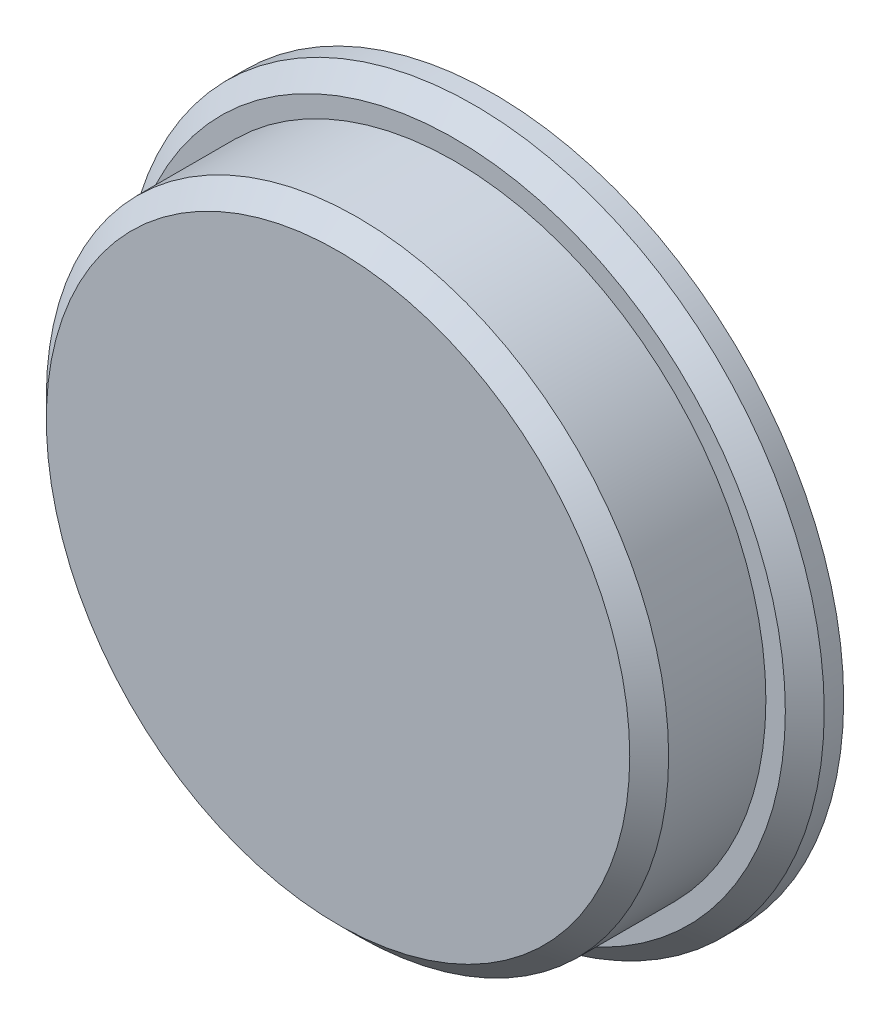
from build123d import *

# Parameters (mm, degrees)
ESQUISSE1_R        = 9
BOSS_EXTRU_1_DEPTH = 1
CHANFREIN1_SIZE    = 0.5
ESQUISSE2_R        = 8
BOSS_EXTRU_2_DEPTH = 3
CHANFREIN2_SIZE    = 0.5


with BuildPart() as part:
    # Esquisse1 → Boss.-Extru.1 (new body)
    with BuildSketch(Plane.XY):
        Circle(ESQUISSE1_R)
    extrude(amount=BOSS_EXTRU_1_DEPTH)

    # Chanfrein1
    chanfrein1_edges = [part.edges().sort_by_distance(p)[0] for p in [
        (-9, 0, 1),
    ]]
    chamfer(chanfrein1_edges, length=CHANFREIN1_SIZE)

    # Esquisse2 → Boss.-Extru.2 (add)
    with BuildSketch(Plane.XY.offset(1)):
        Circle(ESQUISSE2_R)
    extrude(amount=BOSS_EXTRU_2_DEPTH)

    # Chanfrein2
    chanfrein2_edges = [part.edges().sort_by_distance(p)[0] for p in [
        (-8, 0, 4),
    ]]
    chamfer(chanfrein2_edges, length=CHANFREIN2_SIZE)


solid = part.part
